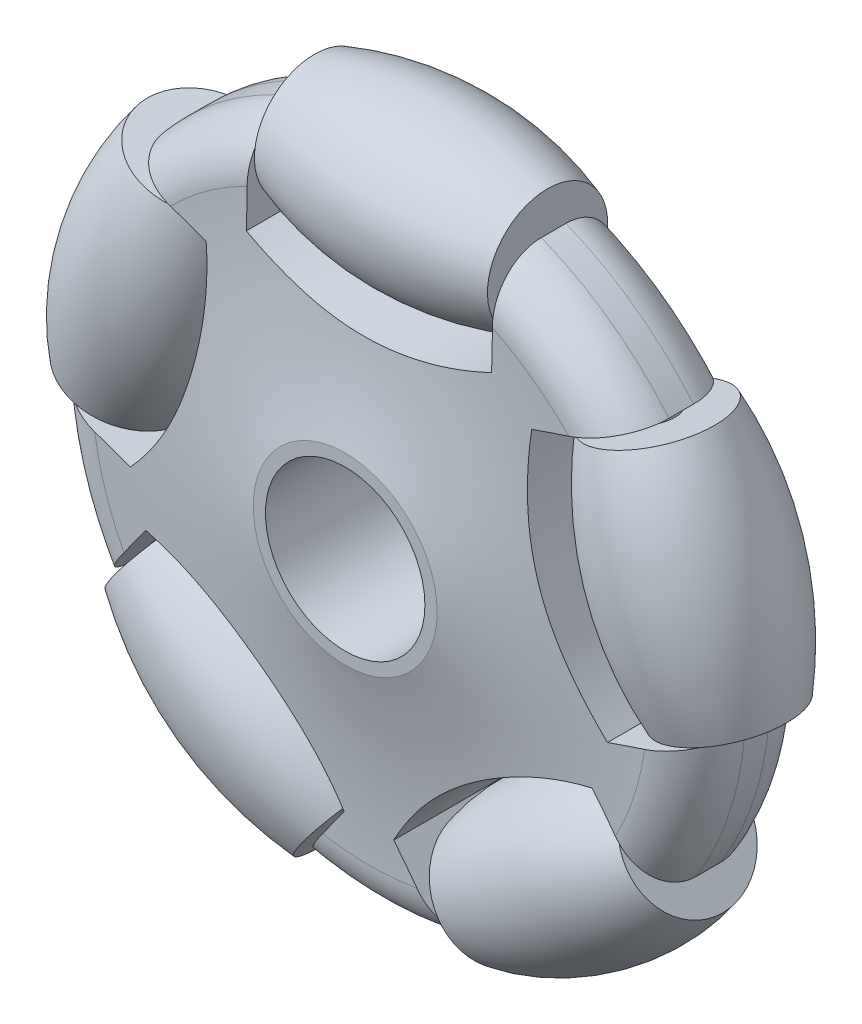
from build123d import *

# Parameters (mm, degrees)
CUT_EXTRUDE1_DEPTH      = 39.333340667
CUT_EXTRUDE1_DEPTH_BACK = 39.333340667
CIRPATTERN1_COUNT       = 5


with BuildPart() as part:
    # Sketch1 → Revolve1 (revolve)
    with BuildSketch(Plane(origin=(0, 0, 0), x_dir=(0, 0, -1), z_dir=(1, 0, 0)), mode=Mode.PRIVATE) as revolve1_sk:
        with BuildLine():
            Line((-1, 26.65), (1, 26.65))
            ThreePointArc((1, 26.65), (3.828427125, 25.478427125), (5, 22.65))
            ThreePointArc((5, 22.65), (5.250271713, 15.058516285), (6, 7.5))
            Line((6, 7.5), (6, 6.5))
            Line((6, 6.5), (-7, 6.5))
            Line((-7, 6.5), (-7, 7.5))
            ThreePointArc((-7, 7.5), (-5.502159658, 15.009278503), (-5, 22.65))
            ThreePointArc((-5, 22.65), (-3.828427125, 25.478427125), (-1, 26.65))
        make_face()
    revolve(revolve1_sk.sketch.rotate(Axis((0, 0, 5), (0, 0, -1)), 90), axis=Axis((0, 0, 5), (0, 0, -1)))

    # Sketch2 → Cut-Extrude1 (cut, two sides: drawn at the far end of the back side and taken through both)
    with BuildSketch(Plane.XY.offset(-CUT_EXTRUDE1_DEPTH_BACK)):
        with BuildLine():
            Line((10, 24.702682041), (10, 17.202682041))
            ThreePointArc((10, 17.202682041), (0, 15.002682041), (-10, 17.202682041))
            Line((-10, 17.202682041), (-10, 24.702682041))
            ThreePointArc((-10, 24.702682041), (0, 26.65), (10, 24.702682041))
        make_face()
        with BuildLine():
            Line((26.583816668, -1.877016606), (19.450892796, -4.194644064))
            ThreePointArc((19.450892796, -4.194644064), (14.268398517, 4.636083712), (13.270552909, 14.826486262))
            Line((13.270552909, 14.826486262), (20.403476781, 17.14411372))
            ThreePointArc((20.403476781, 17.14411372), (25.345656159, 8.2353029), (26.583816668, -1.877016606))
        make_face()
        with BuildLine():
            Line((6.429702252, -25.8627421), (2.02131286, -19.795114643))
            ThreePointArc((2.02131286, -19.795114643), (8.818355248, -12.137424732), (18.201652747, -8.039409597))
            Line((18.201652747, -8.039409597), (22.610042139, -14.107037055))
            ThreePointArc((22.610042139, -14.107037055), (15.664476974, -21.5603029), (6.429702252, -25.8627421))
        make_face()
        with BuildLine():
            Line((-22.610042139, -14.107037055), (-18.201652747, -8.039409597))
            ThreePointArc((-18.201652747, -8.039409597), (-8.818355248, -12.137424732), (-2.02131286, -19.795114643))
            Line((-2.02131286, -19.795114643), (-6.429702252, -25.8627421))
            ThreePointArc((-6.429702252, -25.8627421), (-15.664476974, -21.5603029), (-22.610042139, -14.107037055))
        make_face()
        with BuildLine():
            Line((-20.403476781, 17.14411372), (-13.270552909, 14.826486262))
            ThreePointArc((-13.270552909, 14.826486262), (-14.268398517, 4.636083712), (-19.450892796, -4.194644064))
            Line((-19.450892796, -4.194644064), (-26.583816668, -1.877016606))
            ThreePointArc((-26.583816668, -1.877016606), (-25.345656159, 8.2353029), (-20.403476781, 17.14411372))
        make_face()
    extrude(amount=CUT_EXTRUDE1_DEPTH + CUT_EXTRUDE1_DEPTH_BACK, mode=Mode.SUBTRACT)

    # Sketch3 → Revolve2 (revolve)
    with BuildSketch(Plane.XY):
        with BuildLine():
            Line((9.5, 27.399817518), (9.5, 24))
            Line((9.5, 24), (10, 24))
            Line((10, 24), (10, 22.5))
            Line((10, 22.5), (-10, 22.5))
            Line((-10, 22.5), (-10, 24))
            Line((-10, 24), (-9.5, 24))
            Line((-9.5, 24), (-9.5, 27.399817518))
            ThreePointArc((-9.5, 27.399817518), (0, 29), (9.5, 27.399817518))
        make_face()
    revolve2 = revolve(axis=Axis((10, 22.5, 0), (-1, 0, 0)))

    # CirPattern1: Revolve2 ×5 about axis
    cirpattern1_axis = Axis((0, 0, 0), (0, 0, 1))
    for i in range(1, CIRPATTERN1_COUNT):
        add(revolve2.rotate(cirpattern1_axis, i * 360 / CIRPATTERN1_COUNT))


solid = part.part
